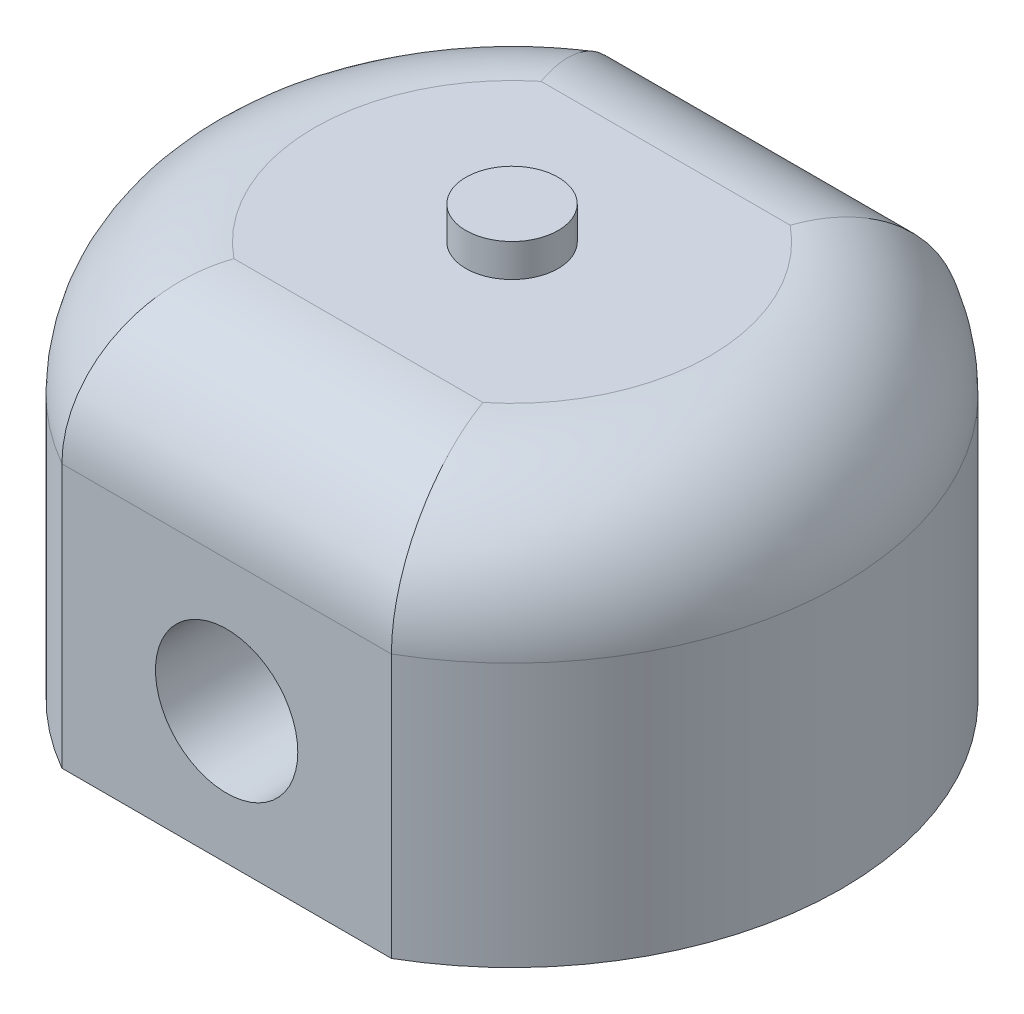
from build123d import *
from build123d.topology import SkipClean

# Parameters (mm, degrees)
SKETCH1_R           = 31.75
BOSS_EXTRUDE1_DEPTH = 38.1
CUT_EXTRUDE1_DEPTH  = 59.887477446
FILLET1_R           = 12.7
SKETCH7_R           = 5.5626
CUT_EXTRUDE2_DEPTH  = 75.053089233
SKETCH8_R           = 4.445
BOSS_EXTRUDE2_DEPTH = 3.175


with BuildPart() as part:
    # Sketch1 → Boss-Extrude1 (new body)
    with BuildSketch(Plane(origin=(0, 0, 0), x_dir=(1, 0, 0), z_dir=(0, 1, 0))):
        with Locations(Location((0, 0, 0), (0, 0, 90))):
            Circle(SKETCH1_R)
    extrude(amount=BOSS_EXTRUDE1_DEPTH)

    # Sketch2 → Cut-Extrude1 (cut, through all)
    with BuildSketch(Plane.XZ):
        with BuildLine():
            Line((-15.875, 27.49630657), (15.875, 27.49630657))
            ThreePointArc((15.875, 27.49630657), (0, 31.75), (-15.875, 27.49630657))
        make_face()
        with BuildLine():
            Line((-15.875, -27.49630657), (15.875, -27.49630657))
            ThreePointArc((15.875, -27.49630657), (0, -31.75), (-15.875, -27.49630657))
        make_face()
    extrude(amount=-CUT_EXTRUDE1_DEPTH, mode=Mode.SUBTRACT)

    # Fillet1
    fillet1_edges = [part.edges().sort_by_distance(p)[0] for p in [
        (-31.75, 38.1, 0),
        (0, 38.1, -27.49630657),
        (31.75, 38.1, 0),
        (0, 38.1, 27.49630657),
    ]]
    fillet(fillet1_edges, radius=FILLET1_R)

    # Sketch4 → 1/4 NPT Tapped Hole1 (revolve, cut)
    with BuildSketch(Plane(origin=(0, 12.7, 27.49630657), x_dir=(0, -1, 0), z_dir=(1, 0, 0))):
        Polygon((0, 0), (0, 20.360347279), (5.5626, 17.018), (5.5626, 9.906), (6.557984794, 9.906), (6.8545837, 0), align=None)
    f_1_4_npt_tapped_hole1 = revolve(axis=Axis((0, 12.7, 33.84630657), (0, 0, -1)), mode=Mode.SUBTRACT)

    # Mirror1: 1/4 NPT Tapped Hole1 across plane
    add(f_1_4_npt_tapped_hole1.mirror(Plane.XY), mode=Mode.SUBTRACT)

    # Sketch6 → 1/4 NPT Tapped Hole2 (revolve, cut)
    with BuildSketch(Plane(origin=(-26.85868109, 12.7, 16.931442647), x_dir=(0.5332737841578493, 0, 0.8459427114940868), z_dir=(0, 1, 0))):
        Polygon((0, 0), (0, 20.360347279), (5.5626, 17.018), (5.5626, 9.906), (6.557984794, 9.906), (6.8545837, 0), align=None)
    revolve(axis=Axis((-32.230417308, 12.7, 20.317731176), (0.8459427114940866, 0, -0.5332737841578492)), mode=Mode.SUBTRACT)

    # Sketch6 at point 2 (carried to point 2, square into its face) → 1/4 NPT Tapped Hole2 at 2 (revolve, cut)
    with BuildSketch(Plane(origin=(-26.85868109, 12.7, -16.931442647), x_dir=(-0.533273808, 0, 0.845942696), z_dir=(0, 1, 0))):
        Polygon((0, 0), (0, 20.360347279), (5.5626, 17.018), (5.5626, 9.906), (6.557984794, 9.906), (6.8545837, 0), align=None)
    revolve(axis=Axis((-32.230417211, 12.7, -20.317731331), (0.845942696, 0, 0.533273808)), mode=Mode.SUBTRACT)

    # Sketch7 → Cut-Extrude2 (cut, through all)
    with SkipClean():  # the faces are left unmerged after this step: merging them gives an invalid solid
        with BuildSketch(Plane(origin=(0, 0, -27.49630657), x_dir=(-1, 0, 0), z_dir=(0, 0, -1))):
            with Locations(Location((0, 12.7, 0), (0, 0, 180))):
                Circle(SKETCH7_R)
        extrude(amount=-CUT_EXTRUDE2_DEPTH, mode=Mode.SUBTRACT)

    # Sketch8 → Boss-Extrude2 (add)
    with SkipClean():  # the faces are left unmerged after this step: merging them gives an invalid solid
        with BuildSketch(Plane(origin=(0, 38.1, 0), x_dir=(1, 0, 0), z_dir=(0, 1, 0))):
            with Locations(Location((0, 0, 0), (0, 0, 270))):
                Circle(SKETCH8_R)
        extrude(amount=BOSS_EXTRUDE2_DEPTH)


solid = part.part
